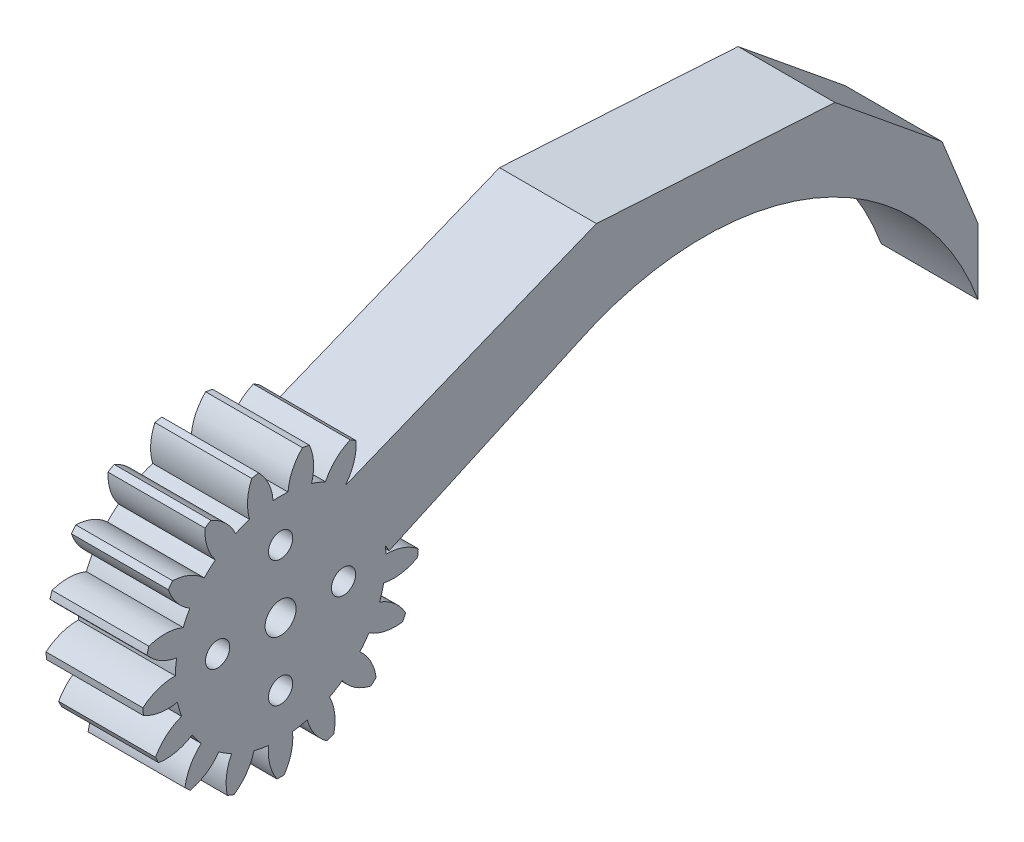
from build123d import *

# Parameters (mm, degrees)
EXTRUDE_1_DEPTH     = 10
SKETCH_2_R          = 1.724202643
CUT_EXTRUDE_1_DEPTH = 10
EXTRUDE_4_DEPTH     = 10
SKETCH_9_R          = 1.6
CUT_EXTRUDE_2_DEPTH = 10
SKETCH_11_R         = 1.25
CUT_EXTRUDE_3_DEPTH = 10
EXTRUDE_6_DEPTH     = 10


with BuildPart() as part:
    # 草图1 → 凸台-拉伸1 (new body)
    with BuildSketch(Plane(origin=(0, 0, 0), x_dir=(0, 0, -1), z_dir=(1, 0, 0))):
        with BuildLine():
            ThreePointArc((-14.42168225, 11.102084181), (-13.045532431, 9.936188758), (-11.349614776, 9.322215004))
            ThreePointArc((-11.349614776, 9.322215004), (-11.447736293, 8.558657104), (-11.491588877, 7.790070448))
            ThreePointArc((-11.491588877, 7.790070448), (-13.271447693, 7.498174815), (-14.838398668, 6.604997843))
            ThreePointArc((-14.838398668, 6.604997843), (-14.809334872, 6.240506841), (-14.770928756, 5.876881533))
            ThreePointArc((-14.770928756, 5.876881533), (-13.066537261, 5.286839082), (-11.263348242, 5.326961726))
            ThreePointArc((-11.263348242, 5.326961726), (-11.079014904, 4.57951961), (-10.842260697, 3.846992516))
            ThreePointArc((-10.842260697, 3.846992516), (-12.396484749, 2.93184878), (-13.534970281, 1.532938077))
            ThreePointArc((-13.534970281, 1.532938077), (-13.376199762, 1.203559394), (-13.209030512, 0.878362781))
            ThreePointArc((-13.209030512, 0.878362781), (-11.406584857, 0.943861805), (-9.739655144, 1.632662062))
            ThreePointArc((-9.739655144, 1.632662062), (-9.297762189, 1.002281928), (-8.812376158, 0.404746239))
            ThreePointArc((-8.812376158, 0.404746239), (-9.931058878, -1.010050366), (-10.487320186, -2.725764159))
            ThreePointArc((-10.487320186, -2.725764159), (-10.220285782, -2.975546107), (-9.946930533, -3.218394419))
            ThreePointArc((-9.946930533, -3.218394419), (-8.289860991, -2.506199926), (-6.984318678, -1.261748348))
            ThreePointArc((-6.984318678, -1.261748348), (-6.344546199, -1.68993017), (-5.676082417, -2.071773947))
            ThreePointArc((-5.676082417, -2.071773947), (-6.208139503, -3.795147302), (-6.107050417, -5.595947529))
            ThreePointArc((-6.107050417, -5.595947529), (-5.767816603, -5.732398305), (-5.425193496, -5.860100307))
            ThreePointArc((-5.425193496, -5.860100307), (-4.137296491, -4.597396158), (-3.369462301, -2.96536334))
            ThreePointArc((-3.369462301, -2.96536334), (-2.618215116, -3.133518522), (-1.856953321, -3.24810027))
            ThreePointArc((-1.856953321, -3.24810027), (-1.730527517, -5.047299252), (-0.985740676, -6.689977865))
            ThreePointArc((-0.985740676, -6.689977865), (-0.62012286, -6.694669036), (-0.254505043, -6.689977865))
            ThreePointArc((-0.254505043, -6.689977865), (0.490281797, -5.047299252), (0.616707602, -3.24810027))
            ThreePointArc((0.616707602, -3.24810027), (1.377969397, -3.133518522), (2.129216582, -2.96536334))
            ThreePointArc((2.129216582, -2.96536334), (2.897050772, -4.597396158), (4.184947776, -5.860100307))
            ThreePointArc((4.184947776, -5.860100307), (4.527570883, -5.732398305), (4.866804697, -5.595947529))
            ThreePointArc((4.866804697, -5.595947529), (4.967893784, -3.795147302), (4.435836697, -2.071773947))
            ThreePointArc((4.435836697, -2.071773947), (5.104300479, -1.68993017), (5.744072958, -1.261748348))
            ThreePointArc((5.744072958, -1.261748348), (7.049615272, -2.506199926), (8.706684814, -3.218394419))
            ThreePointArc((8.706684814, -3.218394419), (8.980040062, -2.975546107), (9.247074467, -2.725764159))
            ThreePointArc((9.247074467, -2.725764159), (8.690813158, -1.010050366), (7.572130439, 0.404746239))
            ThreePointArc((7.572130439, 0.404746239), (8.05751647, 1.002281928), (8.499409425, 1.632662062))
            ThreePointArc((8.499409425, 1.632662062), (10.166339138, 0.943861805), (11.968784793, 0.878362781))
            ThreePointArc((11.968784793, 0.878362781), (12.135954042, 1.203559394), (12.294724562, 1.532938077))
            ThreePointArc((12.294724562, 1.532938077), (11.15623903, 2.93184878), (9.602014977, 3.846992516))
            ThreePointArc((9.602014977, 3.846992516), (9.838769184, 4.57951961), (10.023102523, 5.326961726))
            ThreePointArc((10.023102523, 5.326961726), (11.826291541, 5.286839082), (13.530683036, 5.876881533))
            ThreePointArc((13.530683036, 5.876881533), (13.569089153, 6.240506841), (13.598152949, 6.604997843))
            ThreePointArc((13.598152949, 6.604997843), (12.031201973, 7.498174815), (10.251343158, 7.790070448))
            ThreePointArc((10.251343158, 7.790070448), (10.207490573, 8.558657104), (10.109369057, 9.322215004))
            ThreePointArc((10.109369057, 9.322215004), (11.805286712, 9.936188758), (13.181436531, 11.102084181))
            ThreePointArc((13.181436531, 11.102084181), (13.085892556, 11.455028572), (12.981324401, 11.805405363))
            ThreePointArc((12.981324401, 11.805405363), (11.197533394, 12.072220104), (9.432419612, 11.701445512))
            ThreePointArc((9.432419612, 11.701445512), (9.11388277, 12.402289844), (8.746558253, 13.078840801))
            ThreePointArc((8.746558253, 13.078840801), (10.106161468, 14.263990395), (10.968212953, 15.848278153))
            ThreePointArc((10.968212953, 15.848278153), (10.751622629, 16.142874532), (10.527545033, 16.431816785))
            ThreePointArc((10.527545033, 16.431816785), (8.767824855, 16.036234486), (7.255844503, 15.052864832))
            ThreePointArc((7.255844503, 15.052864832), (6.705643569, 15.591313929), (6.118725263, 16.089485988))
            ThreePointArc((6.118725263, 16.089485988), (6.95839209, 17.685750403), (7.18992041, 19.474463655))
            ThreePointArc((7.18992041, 19.474463655), (6.881535461, 19.670925148), (6.568211345, 19.859409611))
            ThreePointArc((6.568211345, 19.859409611), (5.070221956, 18.854855853), (4.015576359, 17.391700658))
            ThreePointArc((4.015576359, 17.391700658), (3.308019018, 17.695033986), (2.580773493, 17.947546249))
            ThreePointArc((2.580773493, 17.947546249), (2.787102273, 19.73934113), (2.356838247, 21.490904241))
            ThreePointArc((2.356838247, 21.490904241), (1.998307769, 21.562697634), (1.63805329, 21.625268436))
            ThreePointArc((1.63805329, 21.625268436), (0.604106458, 20.147413771), (0.149231348, 18.402080251))
            ThreePointArc((0.149231348, 18.402080251), (-0.62012286, 18.429330964), (-1.389477067, 18.402080251))
            ThreePointArc((-1.389477067, 18.402080251), (-1.844352177, 20.147413771), (-2.87829901, 21.625268436))
            ThreePointArc((-2.87829901, 21.625268436), (-3.238553489, 21.562697634), (-3.597083966, 21.490904241))
            ThreePointArc((-3.597083966, 21.490904241), (-4.027347993, 19.73934113), (-3.821019212, 17.947546249))
            ThreePointArc((-3.821019212, 17.947546249), (-4.548264738, 17.695033986), (-5.255822078, 17.391700658))
            ThreePointArc((-5.255822078, 17.391700658), (-6.310467675, 18.854855853), (-7.808457064, 19.859409611))
            ThreePointArc((-7.808457064, 19.859409611), (-8.121781181, 19.670925148), (-8.43016613, 19.474463655))
            ThreePointArc((-8.43016613, 19.474463655), (-8.198637809, 17.685750403), (-7.358970983, 16.089485988))
            ThreePointArc((-7.358970983, 16.089485988), (-7.945889289, 15.591313929), (-8.496090222, 15.052864832))
            ThreePointArc((-8.496090222, 15.052864832), (-10.008070574, 16.036234486), (-11.767790753, 16.431816785))
            ThreePointArc((-11.767790753, 16.431816785), (-11.991868348, 16.142874532), (-12.208458672, 15.848278153))
            ThreePointArc((-12.208458672, 15.848278153), (-11.346407187, 14.263990395), (-9.986803973, 13.078840801))
            ThreePointArc((-9.986803973, 13.078840801), (-10.35412849, 12.402289844), (-10.672665332, 11.701445512))
            ThreePointArc((-10.672665332, 11.701445512), (-12.437779114, 12.072220104), (-14.221570121, 11.805405363))
            ThreePointArc((-14.221570121, 11.805405363), (-14.326138275, 11.455028572), (-14.42168225, 11.102084181))
        make_face()
    extrude(amount=EXTRUDE_1_DEPTH)

    # 草图2 → 切除-拉伸1 (cut)
    with BuildSketch(Plane(origin=(10, 0, 0), x_dir=(0, 0, -1), z_dir=(1, 0, 0))):
        with Locations((-0.62012286, 7.555330964)):
            Circle(SKETCH_2_R)
    extrude(amount=-CUT_EXTRUDE_1_DEPTH, mode=Mode.SUBTRACT)

    # 草图1<2> → 凸台-拉伸4 (add)
    with BuildSketch(Plane(origin=(0, 0, 0), x_dir=(0, 0, -1), z_dir=(1, 0, 0))):
        with BuildLine():
            ThreePointArc((-14.42168225, 11.102084181), (-13.045532431, 9.936188758), (-11.349614776, 9.322215004))
            ThreePointArc((-11.349614776, 9.322215004), (-11.447736293, 8.558657104), (-11.491588877, 7.790070448))
            ThreePointArc((-11.491588877, 7.790070448), (-13.271447693, 7.498174815), (-14.838398668, 6.604997843))
            ThreePointArc((-14.838398668, 6.604997843), (-14.809334872, 6.240506841), (-14.770928756, 5.876881533))
            ThreePointArc((-14.770928756, 5.876881533), (-13.066537261, 5.286839082), (-11.263348242, 5.326961726))
            ThreePointArc((-11.263348242, 5.326961726), (-11.079014904, 4.57951961), (-10.842260697, 3.846992516))
            ThreePointArc((-10.842260697, 3.846992516), (-12.396484749, 2.93184878), (-13.534970281, 1.532938077))
            ThreePointArc((-13.534970281, 1.532938077), (-13.376199762, 1.203559394), (-13.209030512, 0.878362781))
            ThreePointArc((-13.209030512, 0.878362781), (-11.406584857, 0.943861805), (-9.739655144, 1.632662062))
            ThreePointArc((-9.739655144, 1.632662062), (-9.297762189, 1.002281928), (-8.812376158, 0.404746239))
            ThreePointArc((-8.812376158, 0.404746239), (-9.931058878, -1.010050366), (-10.487320186, -2.725764159))
            ThreePointArc((-10.487320186, -2.725764159), (-10.220285782, -2.975546107), (-9.946930533, -3.218394419))
            ThreePointArc((-9.946930533, -3.218394419), (-8.289860991, -2.506199926), (-6.984318678, -1.261748348))
            ThreePointArc((-6.984318678, -1.261748348), (-6.344546199, -1.68993017), (-5.676082417, -2.071773947))
            ThreePointArc((-5.676082417, -2.071773947), (-6.208139503, -3.795147302), (-6.107050417, -5.595947529))
            ThreePointArc((-6.107050417, -5.595947529), (-5.767816603, -5.732398305), (-5.425193496, -5.860100307))
            ThreePointArc((-5.425193496, -5.860100307), (-4.137296491, -4.597396158), (-3.369462301, -2.96536334))
            ThreePointArc((-3.369462301, -2.96536334), (-2.618215116, -3.133518522), (-1.856953321, -3.24810027))
            ThreePointArc((-1.856953321, -3.24810027), (-1.730527517, -5.047299252), (-0.985740676, -6.689977865))
            ThreePointArc((-0.985740676, -6.689977865), (-0.62012286, -6.694669036), (-0.254505043, -6.689977865))
            ThreePointArc((-0.254505043, -6.689977865), (0.490281797, -5.047299252), (0.616707602, -3.24810027))
            ThreePointArc((0.616707602, -3.24810027), (1.377969397, -3.133518522), (2.129216582, -2.96536334))
            ThreePointArc((2.129216582, -2.96536334), (2.897050772, -4.597396158), (4.184947776, -5.860100307))
            ThreePointArc((4.184947776, -5.860100307), (4.527570883, -5.732398305), (4.866804697, -5.595947529))
            ThreePointArc((4.866804697, -5.595947529), (4.967893784, -3.795147302), (4.435836697, -2.071773947))
            ThreePointArc((4.435836697, -2.071773947), (5.104300479, -1.68993017), (5.744072958, -1.261748348))
            ThreePointArc((5.744072958, -1.261748348), (7.049615272, -2.506199926), (8.706684814, -3.218394419))
            ThreePointArc((8.706684814, -3.218394419), (8.980040062, -2.975546107), (9.247074467, -2.725764159))
            ThreePointArc((9.247074467, -2.725764159), (8.690813158, -1.010050366), (7.572130439, 0.404746239))
            ThreePointArc((7.572130439, 0.404746239), (8.05751647, 1.002281928), (8.499409425, 1.632662062))
            ThreePointArc((8.499409425, 1.632662062), (10.166339138, 0.943861805), (11.968784793, 0.878362781))
            ThreePointArc((11.968784793, 0.878362781), (12.135954042, 1.203559394), (12.294724562, 1.532938077))
            ThreePointArc((12.294724562, 1.532938077), (11.15623903, 2.93184878), (9.602014977, 3.846992516))
            ThreePointArc((9.602014977, 3.846992516), (9.838769184, 4.57951961), (10.023102523, 5.326961726))
            ThreePointArc((10.023102523, 5.326961726), (11.826291541, 5.286839082), (13.530683036, 5.876881533))
            ThreePointArc((13.530683036, 5.876881533), (13.569089153, 6.240506841), (13.598152949, 6.604997843))
            ThreePointArc((13.598152949, 6.604997843), (12.031201973, 7.498174815), (10.251343158, 7.790070448))
            ThreePointArc((10.251343158, 7.790070448), (10.207490573, 8.558657104), (10.109369057, 9.322215004))
            ThreePointArc((10.109369057, 9.322215004), (11.805286712, 9.936188758), (13.181436531, 11.102084181))
            ThreePointArc((13.181436531, 11.102084181), (13.085892556, 11.455028572), (12.981324401, 11.805405363))
            ThreePointArc((12.981324401, 11.805405363), (11.197533394, 12.072220104), (9.432419612, 11.701445512))
            ThreePointArc((9.432419612, 11.701445512), (9.11388277, 12.402289844), (8.746558253, 13.078840801))
            ThreePointArc((8.746558253, 13.078840801), (10.106161468, 14.263990395), (10.968212953, 15.848278153))
            ThreePointArc((10.968212953, 15.848278153), (10.751622629, 16.142874532), (10.527545033, 16.431816785))
            ThreePointArc((10.527545033, 16.431816785), (8.767824855, 16.036234486), (7.255844503, 15.052864832))
            ThreePointArc((7.255844503, 15.052864832), (6.705643569, 15.591313929), (6.118725263, 16.089485988))
            ThreePointArc((6.118725263, 16.089485988), (6.95839209, 17.685750403), (7.18992041, 19.474463655))
            ThreePointArc((7.18992041, 19.474463655), (6.881535461, 19.670925148), (6.568211345, 19.859409611))
            ThreePointArc((6.568211345, 19.859409611), (5.070221956, 18.854855853), (4.015576359, 17.391700658))
            ThreePointArc((4.015576359, 17.391700658), (3.308019018, 17.695033986), (2.580773493, 17.947546249))
            ThreePointArc((2.580773493, 17.947546249), (2.787102273, 19.73934113), (2.356838247, 21.490904241))
            ThreePointArc((2.356838247, 21.490904241), (1.998307769, 21.562697634), (1.63805329, 21.625268436))
            ThreePointArc((1.63805329, 21.625268436), (0.604106458, 20.147413771), (0.149231348, 18.402080251))
            ThreePointArc((0.149231348, 18.402080251), (-0.62012286, 18.429330964), (-1.389477067, 18.402080251))
            ThreePointArc((-1.389477067, 18.402080251), (-1.844352177, 20.147413771), (-2.87829901, 21.625268436))
            ThreePointArc((-2.87829901, 21.625268436), (-3.238553489, 21.562697634), (-3.597083966, 21.490904241))
            ThreePointArc((-3.597083966, 21.490904241), (-4.027347993, 19.73934113), (-3.821019212, 17.947546249))
            ThreePointArc((-3.821019212, 17.947546249), (-4.548264738, 17.695033986), (-5.255822078, 17.391700658))
            ThreePointArc((-5.255822078, 17.391700658), (-6.310467675, 18.854855853), (-7.808457064, 19.859409611))
            ThreePointArc((-7.808457064, 19.859409611), (-8.121781181, 19.670925148), (-8.43016613, 19.474463655))
            ThreePointArc((-8.43016613, 19.474463655), (-8.198637809, 17.685750403), (-7.358970983, 16.089485988))
            ThreePointArc((-7.358970983, 16.089485988), (-7.945889289, 15.591313929), (-8.496090222, 15.052864832))
            ThreePointArc((-8.496090222, 15.052864832), (-10.008070574, 16.036234486), (-11.767790753, 16.431816785))
            ThreePointArc((-11.767790753, 16.431816785), (-11.991868348, 16.142874532), (-12.208458672, 15.848278153))
            ThreePointArc((-12.208458672, 15.848278153), (-11.346407187, 14.263990395), (-9.986803973, 13.078840801))
            ThreePointArc((-9.986803973, 13.078840801), (-10.35412849, 12.402289844), (-10.672665332, 11.701445512))
            ThreePointArc((-10.672665332, 11.701445512), (-12.437779114, 12.072220104), (-14.221570121, 11.805405363))
            ThreePointArc((-14.221570121, 11.805405363), (-14.326138275, 11.455028572), (-14.42168225, 11.102084181))
        make_face()
    extrude(amount=EXTRUDE_4_DEPTH)

    # 草图9 → 切除-拉伸2 (cut)
    with BuildSketch(Plane(origin=(10, 0, 0), x_dir=(0, 0, -1), z_dir=(1, 0, 0))):
        with Locations((-0.62012286, 7.555330964)):
            Circle(SKETCH_9_R)
    extrude(amount=-CUT_EXTRUDE_2_DEPTH, mode=Mode.SUBTRACT)

    # 草图11 → 切除-拉伸3 (cut)
    with BuildSketch(Plane(origin=(10, 0, 0), x_dir=(0, 0, -1), z_dir=(1, 0, 0))):
        with Locations((-0.62012286, 14.055330964)):
            Circle(SKETCH_11_R)
        with Locations((5.87987714, 7.555330964)):
            Circle(SKETCH_11_R)
        with Locations((-0.62012286, 1.055330964)):
            Circle(SKETCH_11_R)
        with Locations((-7.12012286, 7.555330964)):
            Circle(SKETCH_11_R)
    extrude(amount=-CUT_EXTRUDE_3_DEPTH, mode=Mode.SUBTRACT)

    # 草图16 → 凸台-拉伸6 (add)
    with BuildSketch(Plane.ZY):
        with BuildLine():
            Line((-10.583770646, 7.933190096), (-29.994013507, 16.781424296))
            ThreePointArc((-29.994013507, 16.781424296), (-54.404174999, 17.550380418), (-71.385236253, -0.002136105))
            Line((-71.385236253, -0.002136105), (-71.385236253, 6.782613007))
            Line((-71.385236253, 6.782613007), (-67.673564574, 15.976855456))
            Line((-67.673564574, 15.976855456), (-56.616482475, 25.001560632))
            Line((-56.616482475, 25.001560632), (-31.988164712, 26.487244509))
            Line((-31.988164712, 26.487244509), (-6.022868168, 16.005178547))
            Line((-6.022868168, 16.005178547), (-10.583770646, 7.933190096))
        make_face()
    extrude(amount=-EXTRUDE_6_DEPTH)


solid = part.part
